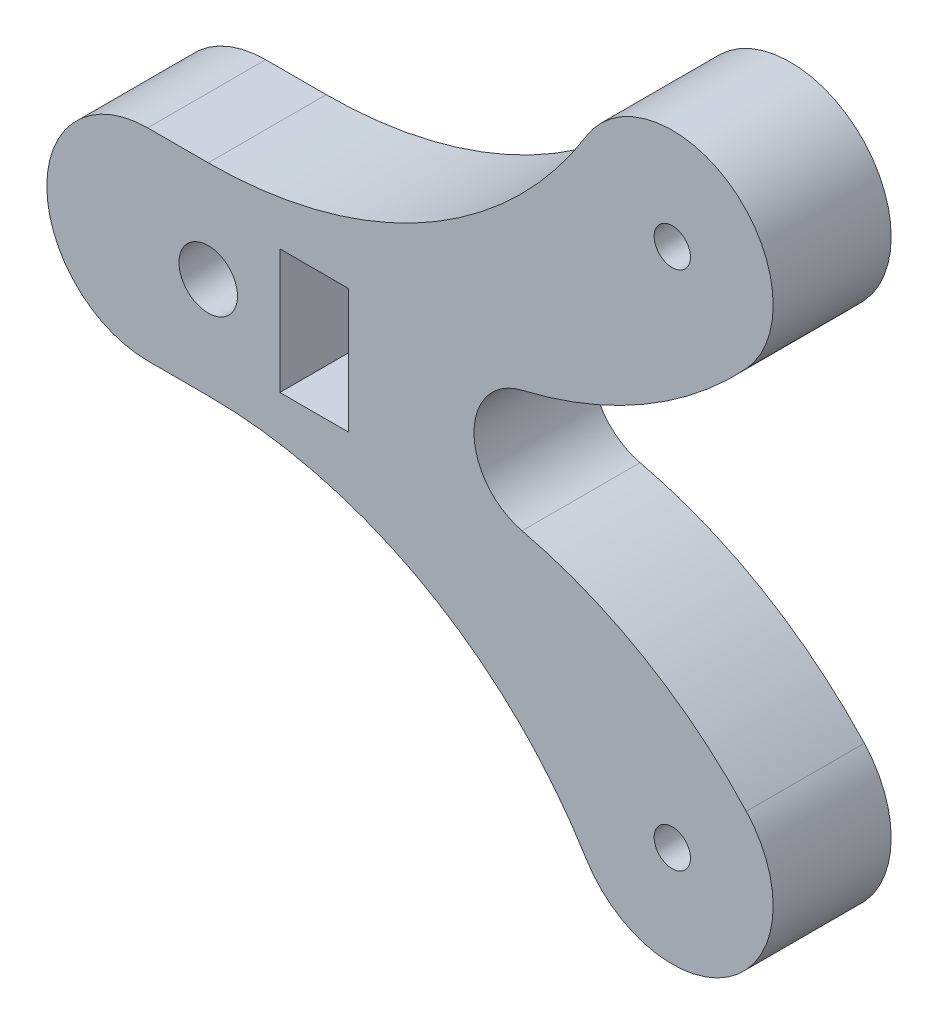
from build123d import *

# Parameters (mm, degrees)
SKETCH1_R           = 0.9
SKETCH1_R_2         = 1.449813
SKETCH1_W           = 3.400011
SKETCH1_H           = 6.165
BOSS_EXTRUDE1_DEPTH = 5.85


with BuildPart() as part:
    # Sketch1 → Boss-Extrude1 (new body)
    with BuildSketch(Plane.XY):
        with BuildLine():
            Line((588.919699582, 440.365819013), (585.919699582, 440.365819013))
            ThreePointArc((585.919699582, 440.365819013), (580.919699582, 435.365819013), (585.919699582, 430.365819013))
            Line((585.919699582, 430.365819013), (588.919699582, 430.365819013))
            ThreePointArc((588.919699582, 430.365819013), (599.656386368, 427.561258519), (607.649897061, 419.864129864))
            ThreePointArc((607.649897061, 419.864129864), (614.934309186, 418.476818019), (615.588112308, 425.863281018))
            ThreePointArc((615.588112308, 425.863281018), (610.514375213, 429.933045921), (604.475645295, 432.349558996))
            ThreePointArc((604.475645295, 432.349558996), (602.091309675, 435.365819013), (604.475645295, 438.382079031))
            ThreePointArc((604.475645295, 438.382079031), (610.514375213, 440.798592106), (615.588112308, 444.868357009))
            ThreePointArc((615.588112308, 444.868357009), (614.934309186, 452.254820008), (607.649897061, 450.867508163))
            ThreePointArc((607.649897061, 450.867508163), (599.656386368, 443.170379508), (588.919699582, 440.365819013))
        make_face()
        with Locations((611.919699582, 448.265819013)):
            Circle(SKETCH1_R, mode=Mode.SUBTRACT)
        with Locations((611.919699582, 422.465819013)):
            Circle(SKETCH1_R, mode=Mode.SUBTRACT)
        with Locations((588.919699582, 435.365819013)):
            Circle(SKETCH1_R_2, mode=Mode.SUBTRACT)
        with Locations((594.169518082, 435.365819013)):
            Rectangle(SKETCH1_W, SKETCH1_H, mode=Mode.SUBTRACT)
    extrude(amount=BOSS_EXTRUDE1_DEPTH)


solid = part.part
